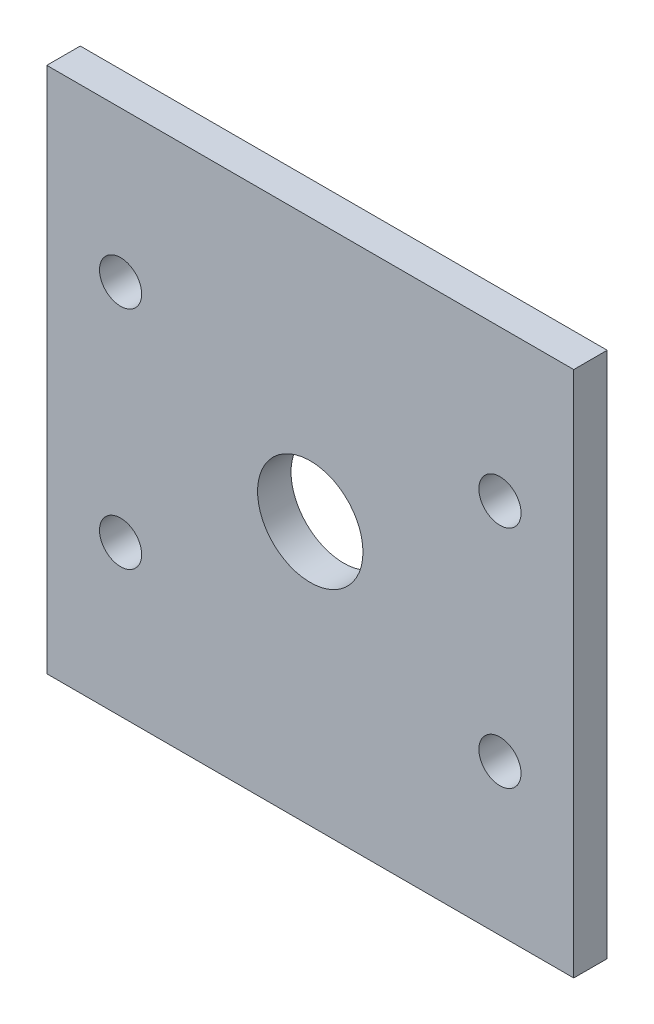
from build123d import *

# Parameters (mm, degrees)
ESQUISSE1_W        = 25
ESQUISSE1_H        = 25
ESQUISSE1_R        = 2.5
ESQUISSE1_R_2      = 1
BOSS_EXTRU_1_DEPTH = 1.5875


with BuildPart() as part:
    # Esquisse1 → Boss.-Extru.1 (new body)
    with BuildSketch(Plane.XY):
        Rectangle(ESQUISSE1_W, ESQUISSE1_H)
        Circle(ESQUISSE1_R, mode=Mode.SUBTRACT)
        with Locations((-9, 5.35)):
            Circle(ESQUISSE1_R_2, mode=Mode.SUBTRACT)
        with Locations((9, 5.35)):
            Circle(ESQUISSE1_R_2, mode=Mode.SUBTRACT)
        with Locations((-9, -5.35)):
            Circle(ESQUISSE1_R_2, mode=Mode.SUBTRACT)
        with Locations((9, -5.35)):
            Circle(ESQUISSE1_R_2, mode=Mode.SUBTRACT)
    extrude(amount=BOSS_EXTRU_1_DEPTH)


solid = part.part
